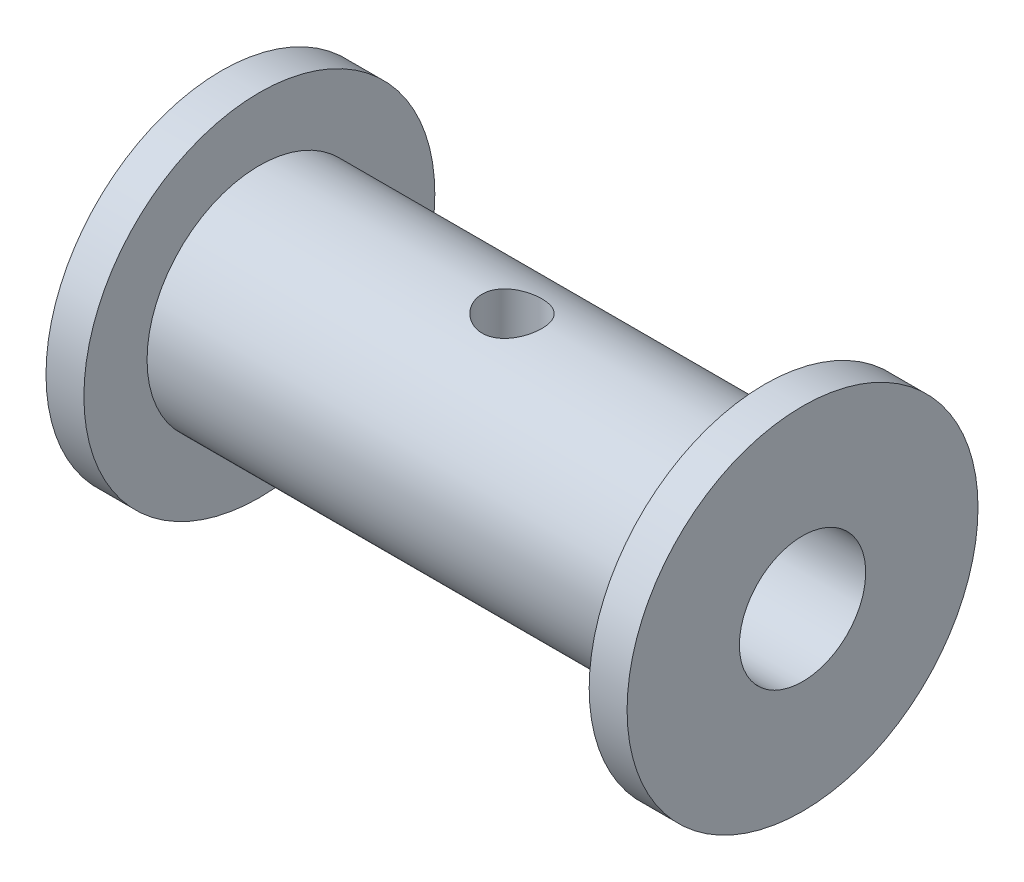
from build123d import *

# Parameters (mm, degrees)
SKETCH2_R          = 1.5
CUT_EXTRUDE1_DEPTH = 20.206668557


with BuildPart() as part:
    # Sketch1 → Revolve1 (revolve)
    with BuildSketch(Plane.XY):
        Polygon((14.605, 3.175), (14.605, 8.82015), (12.7, 8.82015), (12.7, 5.64515), (-12.7, 5.64515), (-12.7, 8.82015), (-14.605, 8.82015), (-14.605, 3.175), align=None)
    revolve(axis=Axis((-15.275524476, 0, 0), (1, 0, 0)))

    # Sketch2 → Cut-Extrude1 (cut, through all)
    with BuildSketch(Plane(origin=(0, 0, 0), x_dir=(1, 0, 0), z_dir=(0, 1, 0))):
        Circle(SKETCH2_R)
    extrude(amount=CUT_EXTRUDE1_DEPTH, mode=Mode.SUBTRACT)


solid = part.part
